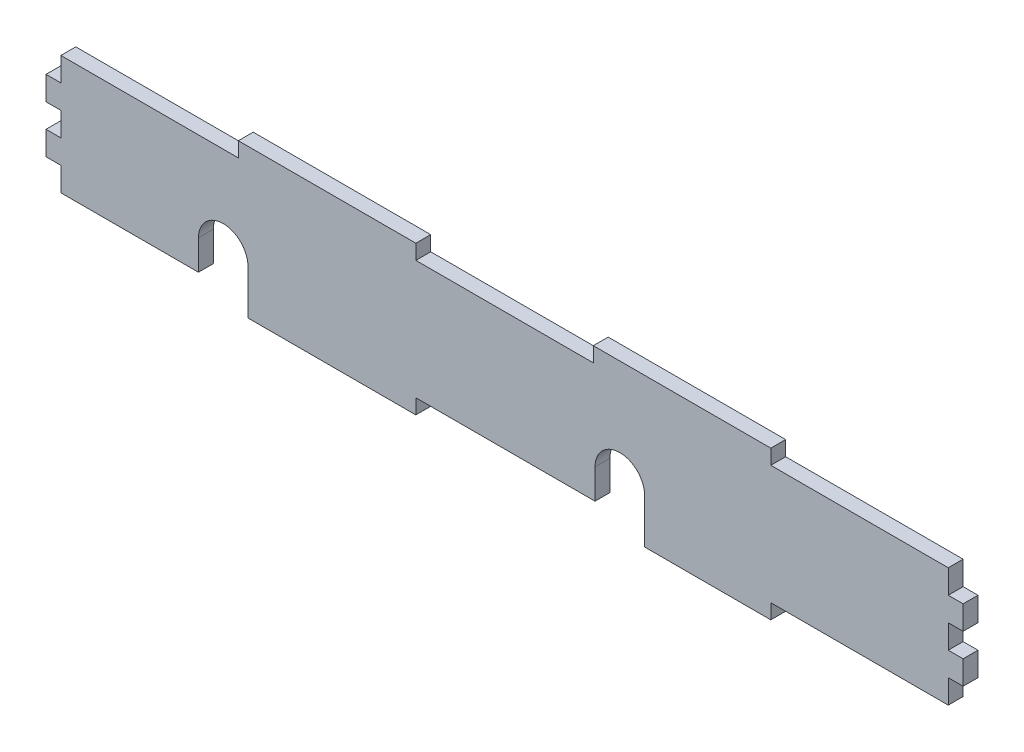
from build123d import *

# Parameters (mm, degrees)
BOSS_EXTRUDE1_DEPTH = 3


with BuildPart() as part:
    # Sketch1 → Boss-Extrude1 (new body)
    with BuildSketch(Plane.XY):
        with BuildLine():
            Line((-4.955370371, 4.8), (-7.955370371, 4.8))
            Line((-7.955370371, 4.8), (-7.955370371, 9.6))
            Line((-7.955370371, 9.6), (-4.955370371, 9.6))
            Line((-4.955370371, 9.6), (-4.955370371, 14.4))
            Line((-4.955370371, 14.4), (-7.955370371, 14.4))
            Line((-7.955370371, 14.4), (-7.955370371, 19.2))
            Line((-7.955370371, 19.2), (-4.955370371, 19.2))
            Line((-4.955370371, 19.2), (-4.955370371, 24))
            Line((-4.955370371, 24), (30.844629629, 24))
            Line((30.844629629, 24), (30.844629629, 27))
            Line((30.844629629, 27), (66.644629629, 27))
            Line((66.644629629, 27), (66.644629629, 24))
            Line((66.644629629, 24), (102.444629629, 24))
            Line((102.444629629, 24), (102.444629629, 27))
            Line((102.444629629, 27), (138.244629629, 27))
            Line((138.244629629, 27), (138.244629629, 24))
            Line((138.244629629, 24), (174.044629629, 24))
            Line((174.044629629, 24), (174.044629629, 19.2))
            Line((174.044629629, 19.2), (177.044629629, 19.2))
            Line((177.044629629, 19.2), (177.044629629, 14.4))
            Line((177.044629629, 14.4), (174.044629629, 14.4))
            Line((174.044629629, 14.4), (174.044629629, 9.6))
            Line((174.044629629, 9.6), (177.044629629, 9.6))
            Line((177.044629629, 9.6), (177.044629629, 4.8))
            Line((177.044629629, 4.8), (174.044629629, 4.8))
            Line((174.044629629, 4.8), (174.044629629, 0))
            Line((174.044629629, 0), (138.244629629, 0))
            Line((138.244629629, 0), (138.244629629, -3))
            Line((138.244629629, -3), (112.794629629, -3))
            Line((112.794629629, -3), (112.794629629, 0))
            Line((112.794629629, 0), (112.794629629, 6))
            ThreePointArc((112.794629629, 6), (107.794629629, 11), (102.794629629, 6))
            Line((102.794629629, 6), (102.794629629, 0))
            Line((102.794629629, 0), (102.444629629, 0))
            Line((102.444629629, 0), (66.644629629, 0))
            Line((66.644629629, 0), (66.644629629, -3))
            Line((66.644629629, -3), (32.794629629, -3))
            Line((32.794629629, -3), (32.794629629, 6))
            ThreePointArc((32.794629629, 6), (27.794629629, 11), (22.794629629, 6))
            Line((22.794629629, 6), (22.794629629, 0))
            Line((22.794629629, 0), (-4.955370371, 0))
            Line((-4.955370371, 0), (-4.955370371, 4.8))
        make_face()
    extrude(amount=BOSS_EXTRUDE1_DEPTH)


solid = part.part
